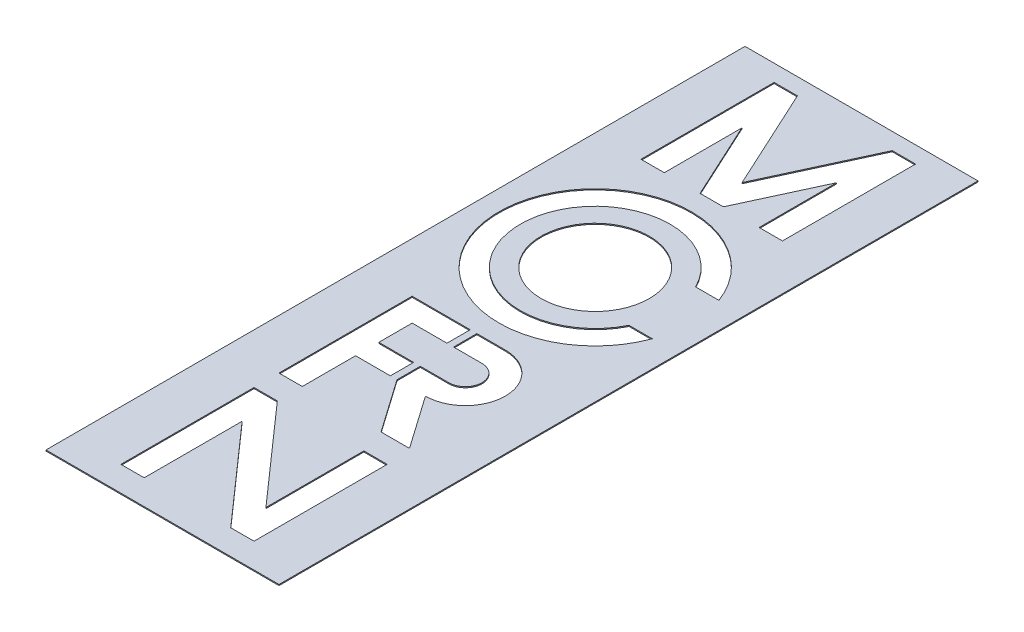
from build123d import *

# Parameters (mm, degrees)
SKETCH1_W             = 88.9
SKETCH1_H             = 266.7
SKETCH1_R             = 20.6375
BOSS_EXTRUDE1_DEPTH   = 0.4
BOSS_EXTRUDE1_2_DEPTH = 0.4
SKETCH2_W             = 2.54
SKETCH2_H             = 30.48
BOSS_EXTRUDE2_DEPTH   = 0.4


with BuildPart() as part:
    # Sketch1 → Boss-Extrude1 (new body)
    with BuildSketch(Plane(origin=(0, 0, 0), x_dir=(1, 0, 0), z_dir=(0, 1, 0))):
        with Locations((26.9875, -76.2)):
            Rectangle(SKETCH1_W, SKETCH1_H)
        with Locations(Location((26.9875, -44.45, 0), (0, 0, 270))):
            Circle(SKETCH1_R, mode=Mode.SUBTRACT)
        Polygon((10.4775, -162.651716191), (10.4775, -200.025), (1.5875, -200.025), (1.5875, -149.225), (10.4775, -149.225), (43.4975, -186.598283809), (43.4975, -149.225), (52.3875, -149.225), (52.3875, -200.025), (43.4975, -200.025), align=None, mode=Mode.SUBTRACT)
        Polygon((31.4325, 0), (22.5425, 0), (8.89, 29.583775771), (8.89, 0), (0, 0), (0, 50.8), (8.89, 50.8), (26.9875, 11.584297234), (45.085, 50.8), (53.975, 50.8), (53.975, 0), (45.085, 0), (45.085, 29.583775771), align=None, mode=Mode.SUBTRACT)
        with BuildLine():
            ThreePointArc((61.475168351, -31.75), (-9.764224698, -44.45), (61.475168351, -57.15))
            Line((61.475168351, -57.15), (52.585168351, -57.15))
            ThreePointArc((52.585168351, -57.15), (-1.5875, -44.45), (52.585168351, -31.75))
            Line((52.585168351, -31.75), (61.475168351, -31.75))
        make_face(mode=Mode.SUBTRACT)
        with BuildLine():
            Line((1.5875, -88.9), (37.1475, -88.9))
            ThreePointArc((37.1475, -88.9), (52.3875, -104.14), (37.1475, -119.38))
            Line((37.1475, -119.38), (51.375717176, -139.7))
            Line((51.375717176, -139.7), (40.523031082, -139.7))
            Line((40.523031082, -139.7), (26.294813906, -119.38))
            Line((26.294813906, -119.38), (10.4775, -119.38))
            Line((10.4775, -119.38), (10.4775, -139.7))
            Line((10.4775, -139.7), (1.5875, -139.7))
            Line((1.5875, -139.7), (1.5875, -88.9))
        make_face(mode=Mode.SUBTRACT)
    extrude(amount=BOSS_EXTRUDE1_DEPTH)



with BuildPart() as body_2:
    # Sketch1 → Boss-Extrude1 2 (new body)
    with BuildSketch(Plane(origin=(0, 0, 0), x_dir=(1, 0, 0), z_dir=(0, 1, 0))):
        with BuildLine():
            ThreePointArc((37.1475, -97.79), (43.4975, -104.14), (37.1475, -110.49))
            Line((37.1475, -110.49), (10.4775, -110.49))
            Line((10.4775, -110.49), (10.4775, -97.79))
            Line((10.4775, -97.79), (37.1475, -97.79))
        make_face()
    extrude(amount=BOSS_EXTRUDE1_2_DEPTH)


with BuildPart() as part_1:
    add(part.part)

    add(body_2.part)  # Boss-Extrude2 merges body 2
    # Sketch2 → Boss-Extrude2 (add)
    with BuildSketch(Plane(origin=(0, 0.4, 0), x_dir=(1, 0, 0), z_dir=(0, 1, 0))):
        with Locations((25.024813906, -104.14)):
            Rectangle(SKETCH2_W, SKETCH2_H)
    extrude(amount=-BOSS_EXTRUDE2_DEPTH)


solid = part_1.part
